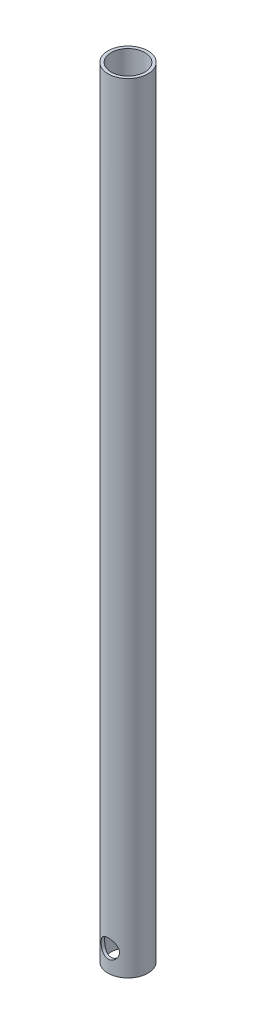
from build123d import *

# Parameters (mm, degrees)
SKETCH_1_R               = 6.5
SKETCH_1_R_2             = 5.5
EXTRUDE_1_DEPTH          = 253.8
CUT_EXTRUDE_1_DEPTH      = 254.966415102
CUT_EXTRUDE_1_DEPTH_BACK = 254.966415102
SKETCH_2_R               = 3


with BuildPart() as part:
    # 草图1 → 凸台-拉伸1 (new body)
    with BuildSketch(Plane(origin=(0, 0, 0), x_dir=(1, 0, 0), z_dir=(0, 1, 0))):
        with Locations(Location((0, 0, 0), (0, 0, 270))):
            Circle(SKETCH_1_R)
        with Locations(Location((0, 0, 0), (0, 0, 270))):
            Circle(SKETCH_1_R_2, mode=Mode.SUBTRACT)
    extrude(amount=EXTRUDE_1_DEPTH)

    # 草图2 → 切除-拉伸1 (cut, two sides: drawn at the far end of the back side and taken through both)
    with BuildSketch(Plane.XY.offset(-CUT_EXTRUDE_1_DEPTH_BACK)):
        with Locations((0, 7)):
            Circle(SKETCH_2_R)
    extrude(amount=CUT_EXTRUDE_1_DEPTH + CUT_EXTRUDE_1_DEPTH_BACK, mode=Mode.SUBTRACT)


solid = part.part
